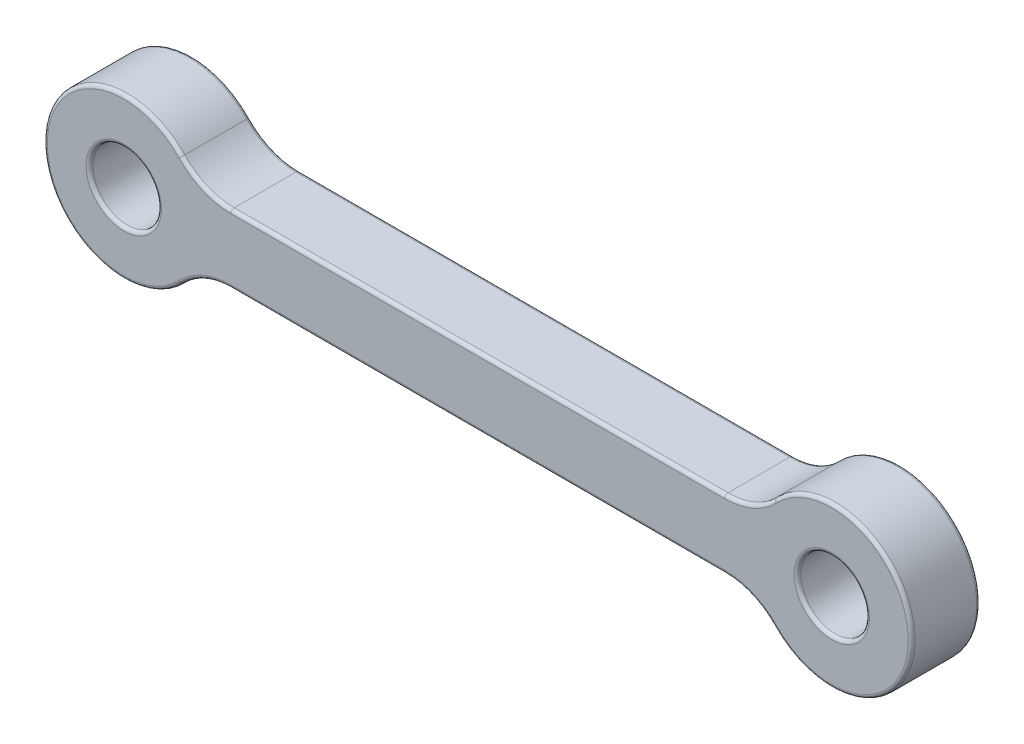
from build123d import *

# Parameters (mm, degrees)
SKETCH1_R           = 3.5
SKETCH1_R_2         = 1.5
BOSS_EXTRUDE1_DEPTH = 1.5
FILLET1_R           = 3
FILLET2_R           = 0.15


with BuildPart() as part:
    # Sketch1 → Boss-Extrude1 (new, symmetric)
    # profile 1 of 3: a face of its own
    with BuildSketch(Plane.XY):
        Circle(SKETCH1_R)
        Circle(SKETCH1_R_2, mode=Mode.SUBTRACT)
    # profile 2 of 3: a face of its own
    with BuildSketch(Plane.XY):
        with BuildLine():
            ThreePointArc((3.5, 0), (3.414525722, -0.768774411), (3.16227766, -1.5))
            Line((3.16227766, -1.5), (27.83772234, -1.5))
            ThreePointArc((27.83772234, -1.5), (27.5, 0), (27.83772234, 1.5))
            Line((27.83772234, 1.5), (3.16227766, 1.5))
            ThreePointArc((3.16227766, 1.5), (3.414525722, 0.768774411), (3.5, 0))
        make_face()
    # profile 3 of 3: a face of its own
    with BuildSketch(Plane.XY):
        with Locations((31, 0)):
            Circle(SKETCH1_R)
        with Locations((31, 0)):
            Circle(SKETCH1_R_2, mode=Mode.SUBTRACT)
    extrude(amount=BOSS_EXTRUDE1_DEPTH, both=True)

    # Fillet1
    fillet1_edges = [part.edges().sort_by_distance(p)[0] for p in [
        (27.83772234, 1.5, 0),
        (27.83772234, -1.5, 0),
        (3.16227766, -1.5, 0),
        (3.16227766, 1.5, 0),
    ]]
    fillet(fillet1_edges, radius=FILLET1_R)

    # Fillet2
    fillet2_edges = [part.edges().sort_by_distance(p)[0] for p in [
        (15.5, -1.5, -1.5),
        (15.5, -1.5, 1.5),
        (-1.5, 0, 1.5),
        (-3.5, 0, -1.5),
        (-3.5, 0, 1.5),
        (34.5, 0, -1.5),
        (34.5, 0, 1.5),
        (29.5, 0, 1.5),
        (15.5, 1.5, -1.5),
        (15.5, 1.5, 1.5),
        (3.513718949, -1.740401367, -1.5),
        (3.513718949, -1.740401367, 1.5),
        (27.486281051, -1.740401367, -1.5),
        (27.486281051, -1.740401367, 1.5),
        (27.486281051, 1.740401367, -1.5),
        (27.486281051, 1.740401367, 1.5),
        (3.513718949, 1.740401367, -1.5),
        (3.513718949, 1.740401367, 1.5),
        (29.5, 0, -1.5),
        (-1.5, 0, -1.5),
    ]]
    fillet(fillet2_edges, radius=FILLET2_R)


solid = part.part
